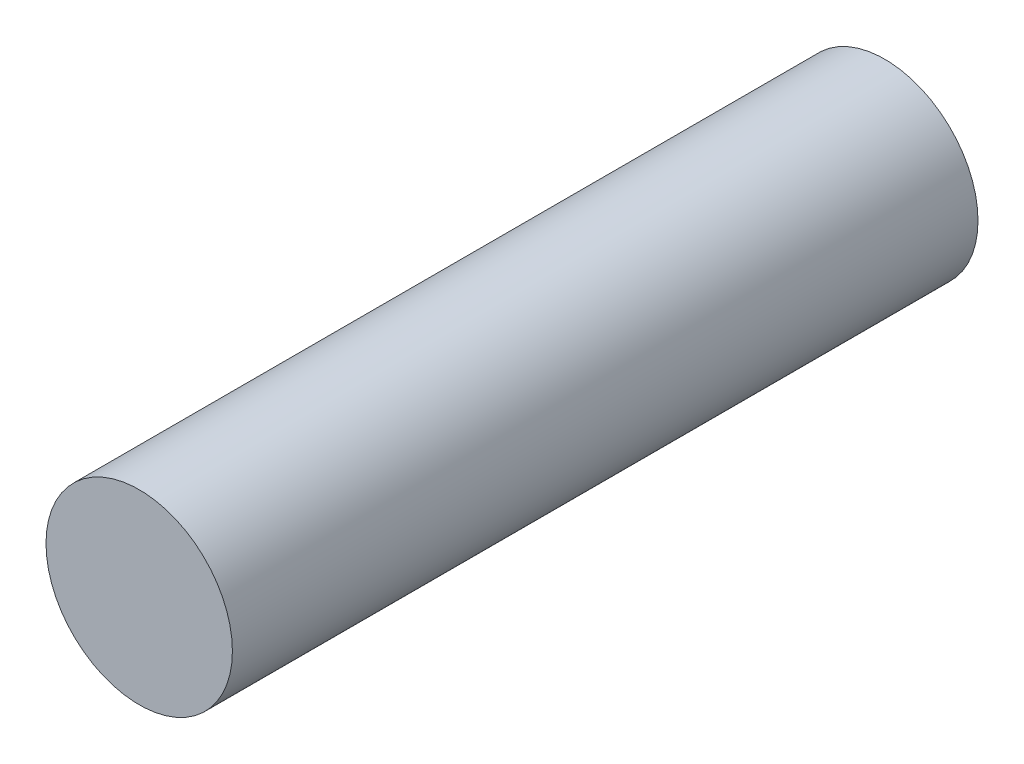
from build123d import *

# Parameters (mm, degrees)
SKETCH1_R           = 3.175
BOSS_EXTRUDE1_DEPTH = 25.4


with BuildPart() as part:
    # Sketch1 → Boss-Extrude1 (new body)
    with BuildSketch(Plane.XY):
        Circle(SKETCH1_R)
    extrude(amount=-BOSS_EXTRUDE1_DEPTH)


solid = part.part
